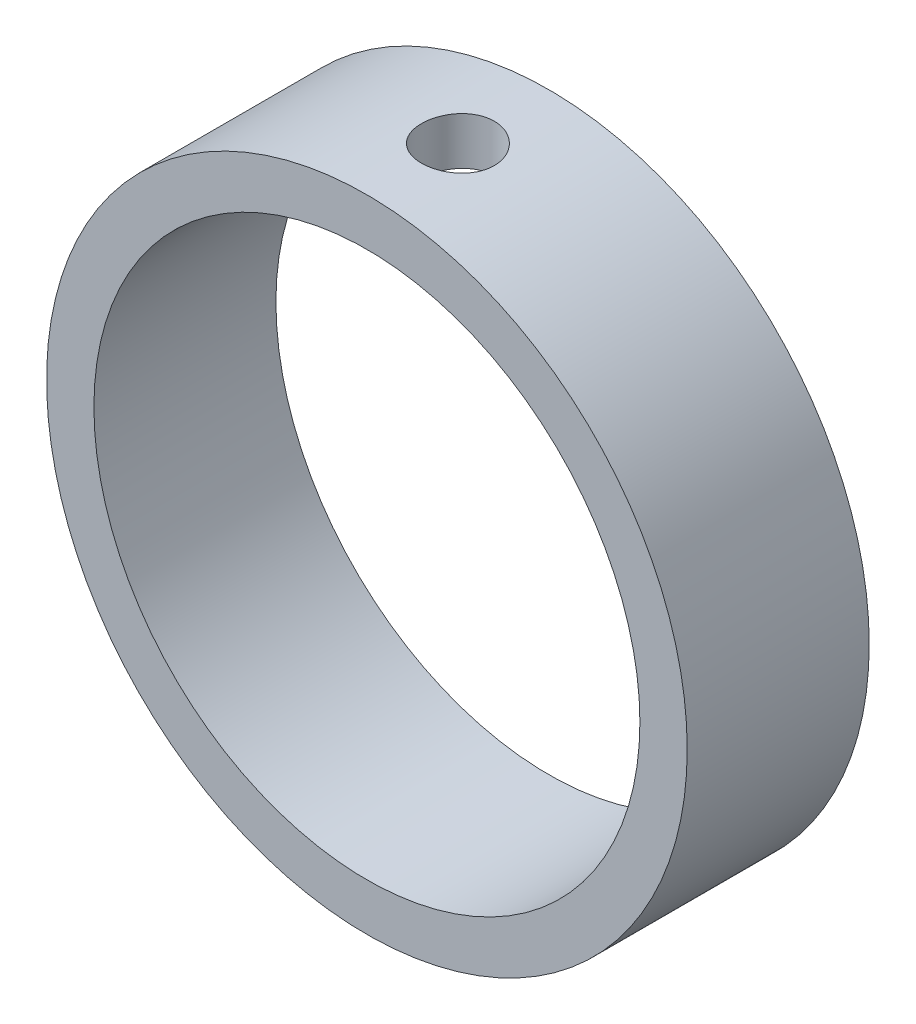
from build123d import *

# Parameters (mm, degrees)
SKETCH1_R           = 44
SKETCH1_R_2         = 37.5
BOSS_EXTRUDE1_DEPTH = 25
SKETCH2_R           = 5
CUT_EXTRUDE1_DEPTH  = 70


with BuildPart() as part:
    # Sketch1 → Boss-Extrude1 (new body)
    with BuildSketch(Plane.XY):
        Circle(SKETCH1_R)
        Circle(SKETCH1_R_2, mode=Mode.SUBTRACT)
    extrude(amount=BOSS_EXTRUDE1_DEPTH)

    # Sketch2 → Cut-Extrude1 (cut)
    with BuildSketch(Plane(origin=(0, 0, 0), x_dir=(1, 0, 0), z_dir=(0, 1, 0))):
        with Locations(Location((0, -12.5, 0), (0, 0, 90))):
            Circle(SKETCH2_R)
    extrude(amount=CUT_EXTRUDE1_DEPTH, mode=Mode.SUBTRACT)


solid = part.part
